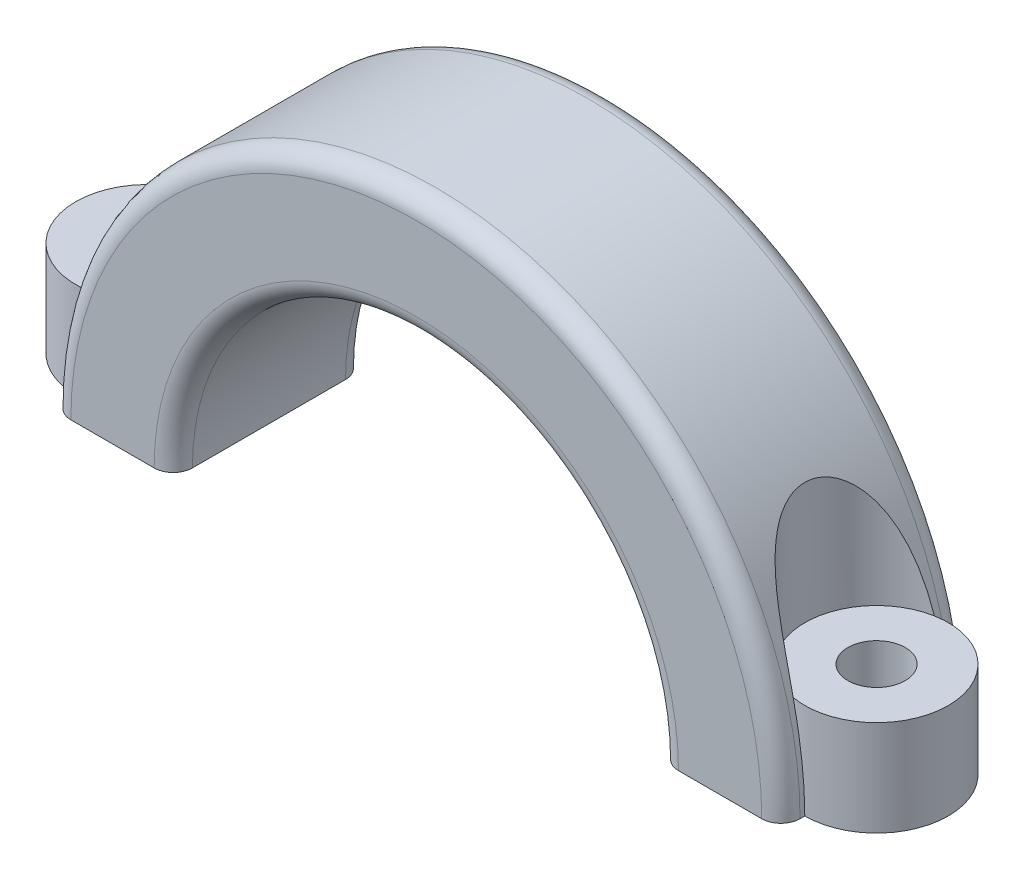
from build123d import *

# Parameters (mm, degrees)
BOSS_EXTRUDE1_DEPTH = 10
SKETCH2_R           = 7.5
BOSS_EXTRUDE4_DEPTH = 10
SKETCH3_R           = 7.5
CUT_EXTRUDE1_DEPTH  = 60
SKETCH4_R           = 3
CUT_EXTRUDE2_DEPTH  = 60
FILLET1_R           = 2


with BuildPart() as part:
    # Sketch1 → Boss-Extrude1 (new, symmetric)
    with BuildSketch(Plane.XY):
        with BuildLine():
            Line((-38.1, 0), (-25.4, 0))
            ThreePointArc((-25.4, 0), (0, 25.4), (25.4, 0))
            Line((25.4, 0), (38.1, 0))
            ThreePointArc((38.1, 0), (0, 38.1), (-38.1, 0))
        make_face()
    extrude(amount=BOSS_EXTRUDE1_DEPTH, both=True)

    # Sketch2 → Boss-Extrude4 (add)
    with BuildSketch(Plane.XZ):
        with Locations((38.1, 0)):
            Circle(SKETCH2_R)
    boss_extrude4 = extrude(amount=-BOSS_EXTRUDE4_DEPTH)

    # Sketch3 → Cut-Extrude1 (cut)
    with BuildSketch(Plane(origin=(0, 10, 0), x_dir=(1, 0, 0), z_dir=(0, 1, 0))):
        with Locations((38.1, 0)):
            Circle(SKETCH3_R)
    cut_extrude1 = extrude(amount=CUT_EXTRUDE1_DEPTH, mode=Mode.SUBTRACT)

    # Sketch4 → Cut-Extrude2 (cut)
    with BuildSketch(Plane.XZ):
        with Locations(Location((38.1, 0, 0), (0, 0, 270))):
            Circle(SKETCH4_R)
    cut_extrude2 = extrude(amount=-CUT_EXTRUDE2_DEPTH, mode=Mode.SUBTRACT)

    # Mirror1: Boss-Extrude4, Cut-Extrude1, Cut-Extrude2 across plane
    add(boss_extrude4.mirror(Plane(origin=(0, 0, 0), x_dir=(0, 0, 1), z_dir=(1, 0, 0))))
    add(cut_extrude1.mirror(Plane(origin=(0, 0, 0), x_dir=(0, 0, 1), z_dir=(1, 0, 0))), mode=Mode.SUBTRACT)
    add(cut_extrude2.mirror(Plane(origin=(0, 0, 0), x_dir=(0, 0, 1), z_dir=(1, 0, 0))), mode=Mode.SUBTRACT)

    # Fillet1
    fillet1_edges = [part.edges().sort_by_distance(p)[0] for p in [
        (0, 38.1, 10),
        (0, 25.4, 10),
        (0, 38.1, -10),
        (0, 25.4, -10),
    ]]
    fillet(fillet1_edges, radius=FILLET1_R)


solid = part.part
